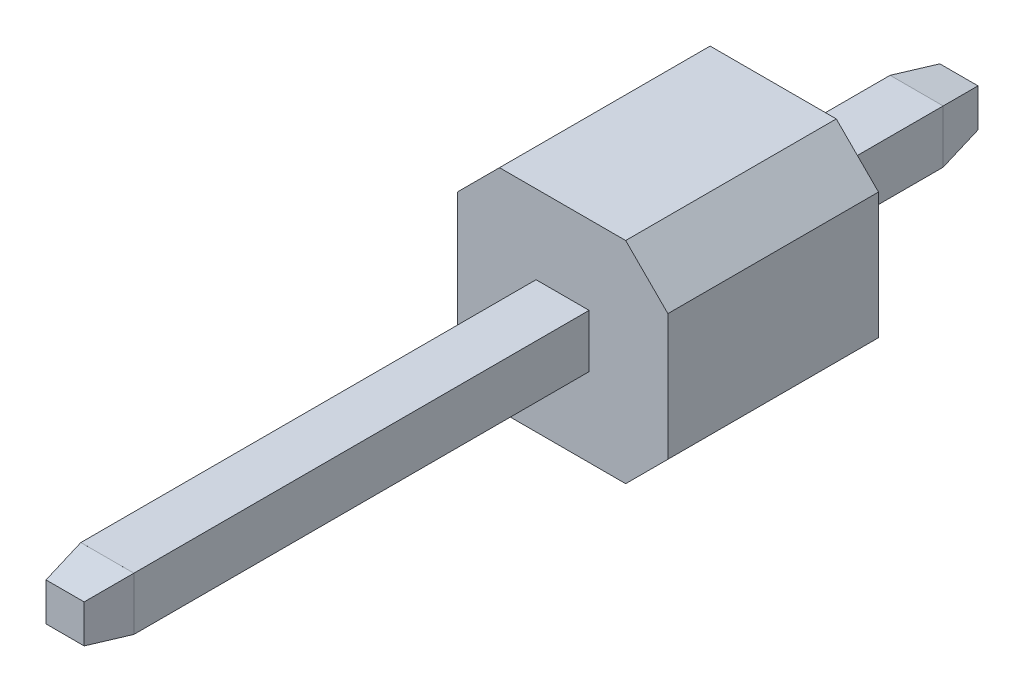
from build123d import *

# Parameters (mm, degrees)
SKETCH_1_W           = 2.54
SKETCH_1_H           = 2.54
EXTRUDE_1_DEPTH      = 2.54
EXTRUDE_2_DEPTH      = 8.03
EXTRUDE_2_DEPTH_BACK = 1.73
SKETCH_2_W           = 0.64
SKETCH_2_H           = 0.64
SKETCH_3_W           = 0.46
SKETCH_3_H           = 0.46
EXTRUDE_3_DEPTH      = 0.51
SKETCH_4_W           = 0.46
SKETCH_4_H           = 0.46
EXTRUDE_4_DEPTH      = 0.51
DRAFT_2_ANGLE        = 10
DRAFT_3_ANGLE        = 10
CHAMFER_1_SIZE       = 0.509116882


with BuildPart() as part:
    # ｽｹｯﾁ1 → ﾎﾞｽ - 押し出し1 (new body)
    with BuildSketch(Plane.XY):
        Rectangle(SKETCH_1_W, SKETCH_1_H)
    extrude(amount=EXTRUDE_1_DEPTH)

    # ｽｹｯﾁ2 → ﾎﾞｽ - 押し出し2 (add, two sides: drawn at the far end of the back side and taken through both)
    with BuildSketch(Plane.XY.offset(-EXTRUDE_2_DEPTH_BACK)):
        Rectangle(SKETCH_2_W, SKETCH_2_H)
    extrude(amount=EXTRUDE_2_DEPTH + EXTRUDE_2_DEPTH_BACK)

    # ｽｹｯﾁ3 → ﾎﾞｽ - 押し出し3 (add)
    with BuildSketch(Plane(origin=(0, 0, -1.73), x_dir=(-1, 0, 0), z_dir=(0, 0, -1))):
        Rectangle(SKETCH_3_W, SKETCH_3_H)
    extrude(amount=EXTRUDE_3_DEPTH)

    # ｽｹｯﾁ4 → ﾎﾞｽ - 押し出し4 (add)
    with BuildSketch(Plane.XY.offset(8.03)):
        Rectangle(SKETCH_4_W, SKETCH_4_H)
    extrude(amount=EXTRUDE_4_DEPTH)

    # 抜き勾配2
    draft_2_faces = [part.faces().sort_by_distance(p)[0] for p in [
        (0, -0.23, 8.285),
        (-0.23, 0, 8.285),
        (0, 0.23, 8.285),
        (0.23, 0, 8.285),
    ]]
    draft(draft_2_faces, Plane.XY.offset(8.54), DRAFT_2_ANGLE)

    # 抜き勾配3
    draft_3_faces = [part.faces().sort_by_distance(p)[0] for p in [
        (-0.23, 0, -1.985),
        (0, -0.23, -1.985),
        (0.23, 0, -1.985),
        (0, 0.23, -1.985),
    ]]
    draft(draft_3_faces, Plane(origin=(0, 0, -2.24), x_dir=(-1, 0, 0), z_dir=(0, 0, -1)), DRAFT_3_ANGLE)

    # 面取り1
    chamfer_1_edges = [part.edges().sort_by_distance(p)[0] for p in [
        (1.27, -1.27, 1.27),
        (-1.27, -1.27, 1.27),
        (-1.27, 1.27, 1.27),
        (1.27, 1.27, 1.27),
    ]]
    chamfer(chamfer_1_edges, length=CHAMFER_1_SIZE)


solid = part.part
